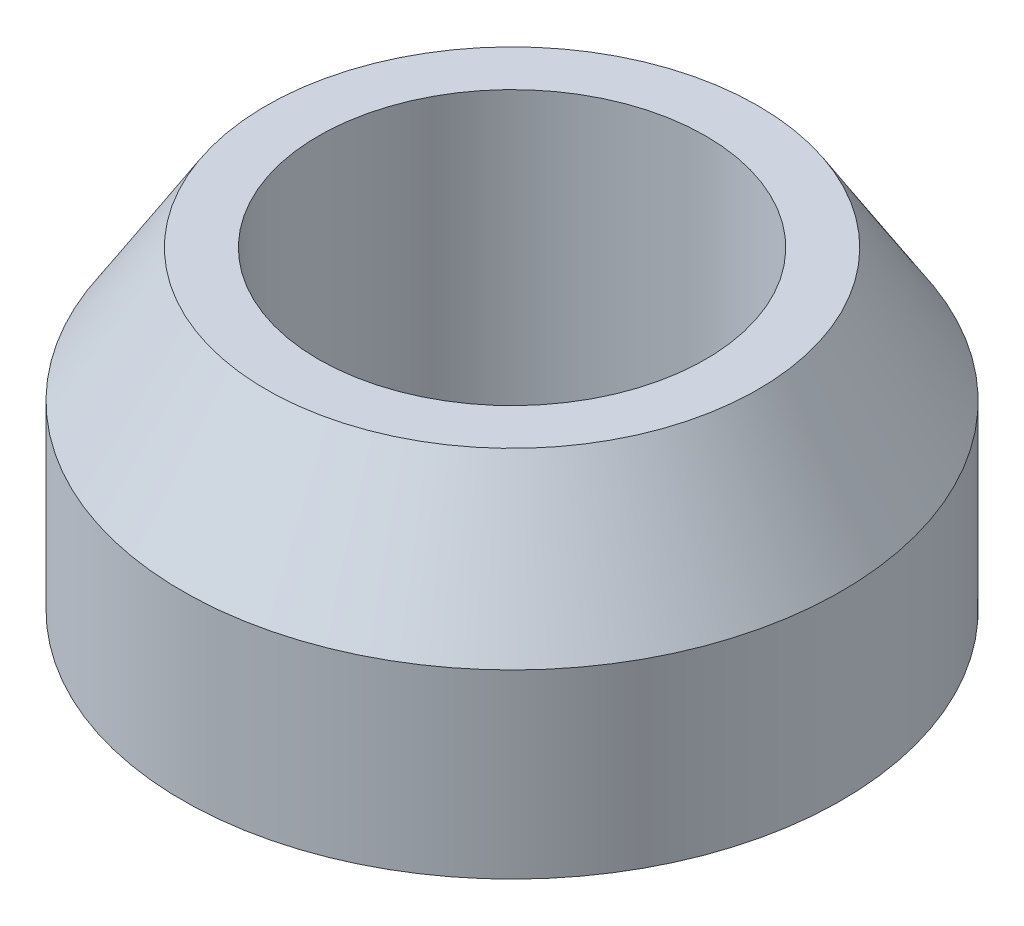
from build123d import *


with BuildPart() as part:
    # Sketch1 → Revolve1 (revolve)
    with BuildSketch(Plane.XY, mode=Mode.PRIVATE) as revolve1_sk:
        Polygon((3.15, 0), (3.15, 1.731142246), (2.35, 3), (1.85, 3), (1.85, 0), align=None)
    revolve(revolve1_sk.sketch.rotate(Axis((0, 0, 0), (0, 1, 0)), 90), axis=Axis((0, 0, 0), (0, 1, 0)))


solid = part.part
